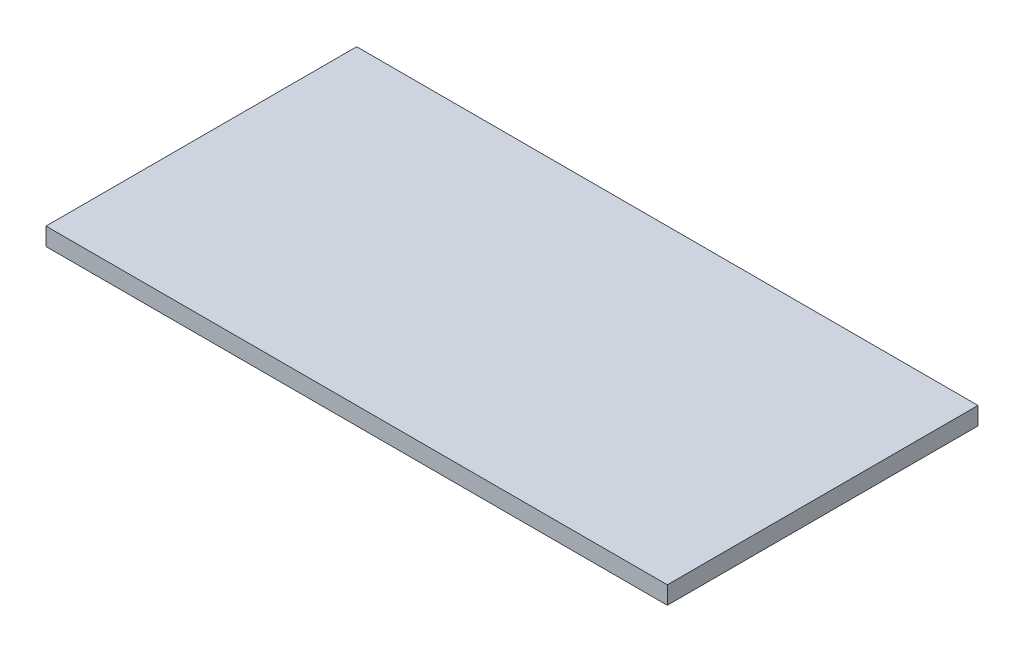
from build123d import *

# Parameters (mm, degrees)
SKETCH1_W           = 88.9
SKETCH1_H           = 44.45
BOSS_EXTRUDE1_DEPTH = 2.54


with BuildPart() as part:
    # Sketch1 → Boss-Extrude1 (new body)
    with BuildSketch(Plane(origin=(0, 0, 0), x_dir=(1, 0, 0), z_dir=(0, 1, 0))):
        with Locations((44.45, 22.225)):
            Rectangle(SKETCH1_W, SKETCH1_H)
    extrude(amount=BOSS_EXTRUDE1_DEPTH)


solid = part.part
